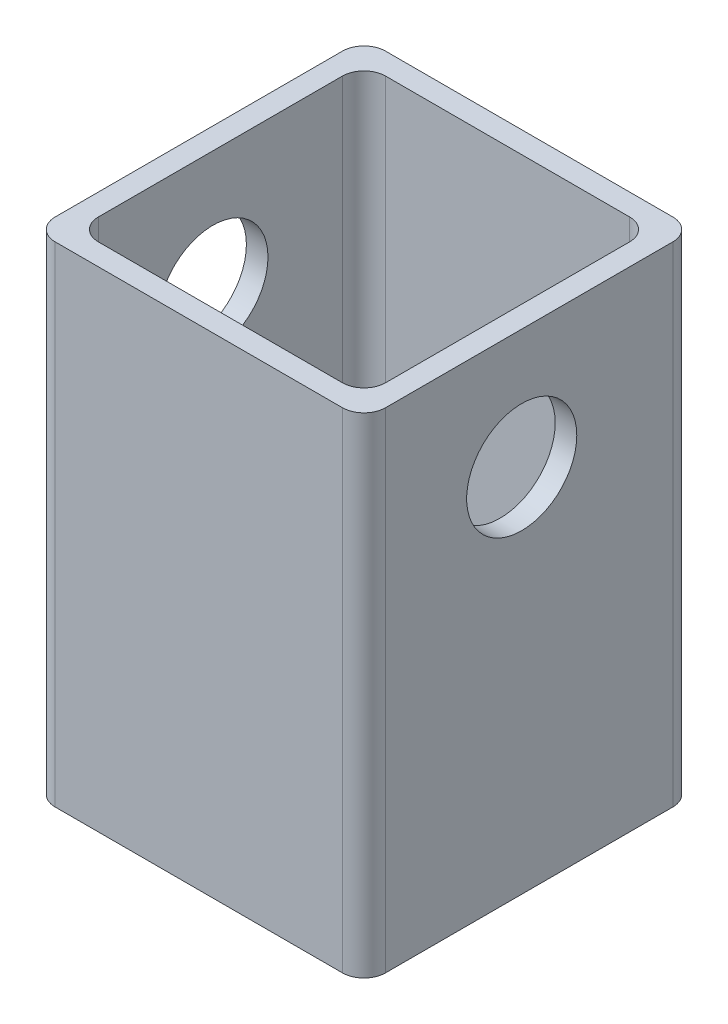
from build123d import *

# Parameters (mm, degrees)
SQUARE_TUBE_75X049_1_DEPTH = 28.221723784
SKETCH3_R                  = 3.175
CUT_EXTRUDE1_DEPTH         = 36.356665826


with BuildPart() as part:
    # Sketch1 → Square tube 75X049(1) (new body)
    with BuildSketch(Plane(origin=(0, 28.221723784, 0), x_dir=(0, 0, -1), z_dir=(0, -1, 0))):
        with BuildLine():
            Line((-8.2804, 9.525), (8.2804, 9.525))
            ThreePointArc((8.2804, 9.525), (9.1604651, 9.1604651), (9.525, 8.2804))
            Line((9.525, 8.2804), (9.525, -8.2804))
            ThreePointArc((9.525, -8.2804), (9.1604651, -9.1604651), (8.2804, -9.525))
            Line((8.2804, -9.525), (-8.2804, -9.525))
            ThreePointArc((-8.2804, -9.525), (-9.1604651, -9.1604651), (-9.525, -8.2804))
            Line((-9.525, -8.2804), (-9.525, 8.2804))
            ThreePointArc((-9.525, 8.2804), (-9.1604651, 9.1604651), (-8.2804, 9.525))
        make_face()
        with BuildLine():
            Line((-8.2804, 7.0358), (-8.2804, -7.0358))
            ThreePointArc((-8.2804, -7.0358), (-7.9158651, -7.9158651), (-7.0358, -8.2804))
            Line((-7.0358, -8.2804), (7.0358, -8.2804))
            ThreePointArc((7.0358, -8.2804), (7.9158651, -7.9158651), (8.2804, -7.0358))
            Line((8.2804, -7.0358), (8.2804, 7.0358))
            ThreePointArc((8.2804, 7.0358), (7.9158651, 7.9158651), (7.0358, 8.2804))
            Line((7.0358, 8.2804), (-7.0358, 8.2804))
            ThreePointArc((-7.0358, 8.2804), (-7.9158651, 7.9158651), (-8.2804, 7.0358))
        make_face(mode=Mode.SUBTRACT)
    extrude(amount=SQUARE_TUBE_75X049_1_DEPTH)

    # Sketch3 → Cut-Extrude1 (cut, through all)
    with BuildSketch(Plane(origin=(9.525, 0, 0), x_dir=(0, 0, -1), z_dir=(1, 0, 0))):
        with Locations((-0.431467727, 21.331601206)):
            Circle(SKETCH3_R)
    extrude(amount=-CUT_EXTRUDE1_DEPTH, mode=Mode.SUBTRACT)


solid = part.part
